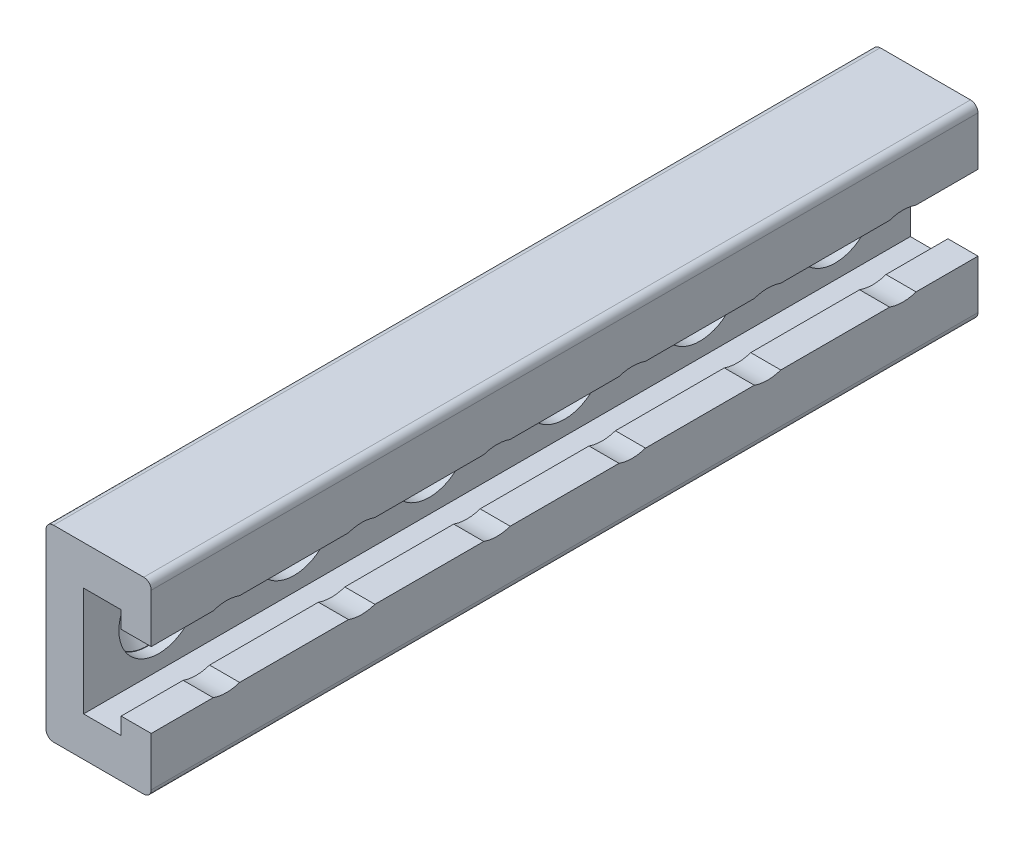
from build123d import *

# Parameters (mm, degrees)
EXTRUDE_1_DEPTH     = 110
SKETCH_2_R          = 2.75
CUT_EXTRUDE_2_DEPTH = 110
SKETCH_3_R          = 5.3
CUT_EXTRUDE_3_DEPTH = 10.6
CHAMFER_1_SIZE      = 2.5
CHAMFER_2_SIZE      = 2.5
CHAMFER_3_SIZE      = 2.5
CHAMFER_4_SIZE      = 2.5
CHAMFER_5_SIZE      = 2.5
CHAMFER_6_SIZE      = 2.5


with BuildPart() as part:
    # 草图1 → 拉伸1 (new body)
    with BuildSketch(Plane.XY):
        with BuildLine():
            Line((1315.337068447, 1002.71396169), (1315.337068447, 1025.71396169))
            ThreePointArc((1315.337068447, 1025.71396169), (1315.629961666, 1026.421068471), (1316.337068447, 1026.71396169))
            Line((1316.337068447, 1026.71396169), (1328.337068447, 1026.71396169))
            ThreePointArc((1328.337068447, 1026.71396169), (1329.044175228, 1026.421068471), (1329.337068447, 1025.71396169))
            Line((1329.337068447, 1025.71396169), (1329.337068447, 1019.21396169))
            Line((1329.337068447, 1019.21396169), (1325.337068447, 1019.21396169))
            Line((1325.337068447, 1019.21396169), (1325.337068447, 1021.46396169))
            Line((1325.337068447, 1021.46396169), (1320.337068447, 1021.46396169))
            Line((1320.337068447, 1021.46396169), (1320.337068447, 1006.96396169))
            Line((1320.337068447, 1006.96396169), (1325.337068447, 1006.96396169))
            Line((1325.337068447, 1006.96396169), (1325.337068447, 1009.21396169))
            Line((1325.337068447, 1009.21396169), (1329.337068447, 1009.21396169))
            Line((1329.337068447, 1009.21396169), (1329.337068447, 1002.71396169))
            ThreePointArc((1329.337068447, 1002.71396169), (1329.044175228, 1002.006854909), (1328.337068447, 1001.71396169))
            Line((1328.337068447, 1001.71396169), (1316.337068447, 1001.71396169))
            ThreePointArc((1316.337068447, 1001.71396169), (1315.629961666, 1002.006854909), (1315.337068447, 1002.71396169))
        make_face()
    extrude(amount=EXTRUDE_1_DEPTH)

    # 草图2 → 拉伸2 (cut)
    with BuildSketch(Plane.ZY.offset(-1315.337068447)):
        with Locations((100, 1014.21396169)):
            Circle(SKETCH_2_R)
        with Locations((82, 1014.21396169)):
            Circle(SKETCH_2_R)
        with Locations((64, 1014.21396169)):
            Circle(SKETCH_2_R)
        with Locations((46, 1014.21396169)):
            Circle(SKETCH_2_R)
        with Locations((28, 1014.21396169)):
            Circle(SKETCH_2_R)
        with Locations((10, 1014.21396169)):
            Circle(SKETCH_2_R)
    extrude(amount=-CUT_EXTRUDE_2_DEPTH, mode=Mode.SUBTRACT)

    # 草图3 → 拉伸3 (cut)
    with BuildSketch(Plane(origin=(1329.337068447, 0, 0), x_dir=(0, 0, -1), z_dir=(1, 0, 0))):
        with Locations((-100, 1014.21396169)):
            Circle(SKETCH_3_R)
        with Locations((-82, 1014.21396169)):
            Circle(SKETCH_3_R)
        with Locations((-64, 1014.21396169)):
            Circle(SKETCH_3_R)
        with Locations((-46, 1014.21396169)):
            Circle(SKETCH_3_R)
        with Locations((-28, 1014.21396169)):
            Circle(SKETCH_3_R)
        with Locations((-10, 1014.21396169)):
            Circle(SKETCH_3_R)
    extrude(amount=-CUT_EXTRUDE_3_DEPTH, mode=Mode.SUBTRACT)

    # 倒角1
    chamfer_1_edges = [part.edges().sort_by_distance(p)[0] for p in [
        (1318.737068447, 1014.21396169, 97.25),
    ]]
    chamfer(chamfer_1_edges, length=CHAMFER_1_SIZE)

    # 倒角2
    chamfer_2_edges = [part.edges().sort_by_distance(p)[0] for p in [
        (1318.737068447, 1014.21396169, 79.25),
    ]]
    chamfer(chamfer_2_edges, length=CHAMFER_2_SIZE)

    # 倒角3
    chamfer_3_edges = [part.edges().sort_by_distance(p)[0] for p in [
        (1318.737068447, 1014.21396169, 61.25),
    ]]
    chamfer(chamfer_3_edges, length=CHAMFER_3_SIZE)

    # 倒角4
    chamfer_4_edges = [part.edges().sort_by_distance(p)[0] for p in [
        (1318.737068447, 1014.21396169, 43.25),
    ]]
    chamfer(chamfer_4_edges, length=CHAMFER_4_SIZE)

    # 倒角5
    chamfer_5_edges = [part.edges().sort_by_distance(p)[0] for p in [
        (1318.737068447, 1014.21396169, 25.25),
    ]]
    chamfer(chamfer_5_edges, length=CHAMFER_5_SIZE)

    # 倒角6
    chamfer_6_edges = [part.edges().sort_by_distance(p)[0] for p in [
        (1318.737068447, 1014.21396169, 7.25),
    ]]
    chamfer(chamfer_6_edges, length=CHAMFER_6_SIZE)


solid = part.part
